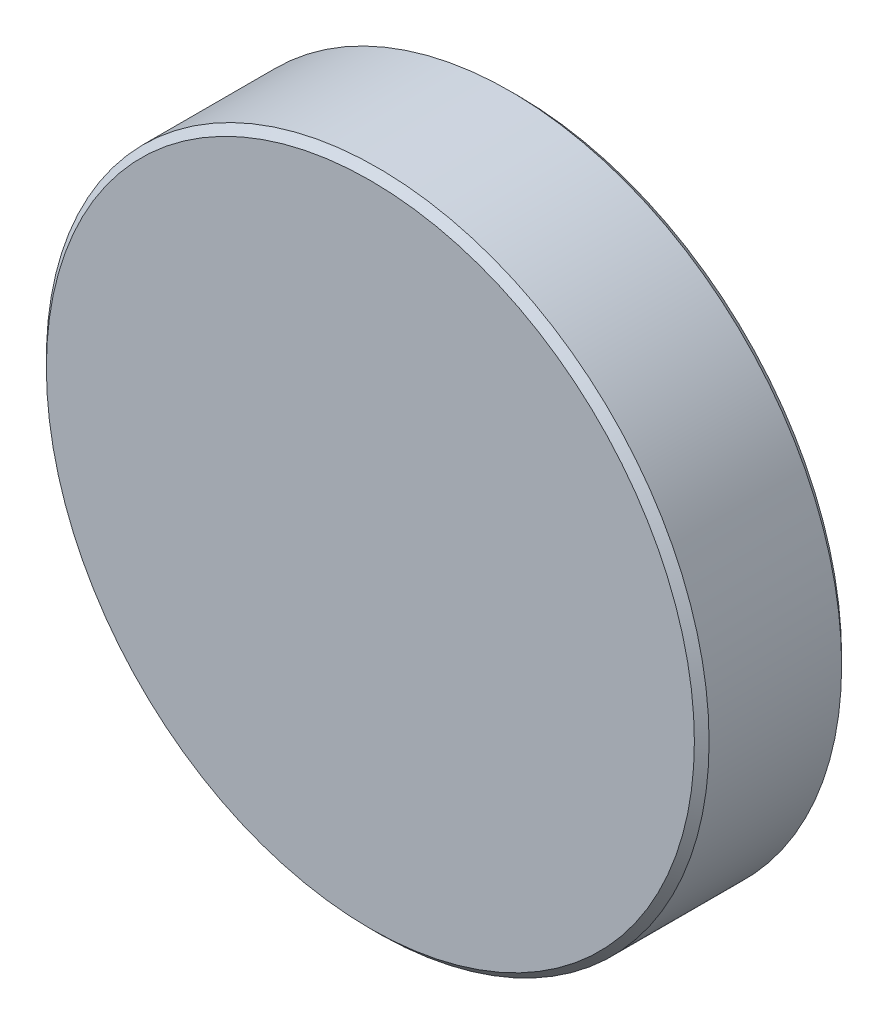
from build123d import *

# Parameters (mm, degrees)
SKETCH1_R           = 4.5
BOSS_EXTRUDE1_DEPTH = 2
CHAMFER1_SIZE       = 0.1


with BuildPart() as part:
    # Sketch1 → Boss-Extrude1 (new body)
    with BuildSketch(Plane.XY):
        Circle(SKETCH1_R)
    extrude(amount=BOSS_EXTRUDE1_DEPTH)

    # Chamfer1
    chamfer1_edges = [part.edges().sort_by_distance(p)[0] for p in [
        (-4.5, 0, 0),
        (-4.5, 0, 2),
    ]]
    chamfer(chamfer1_edges, length=CHAMFER1_SIZE)


solid = part.part
